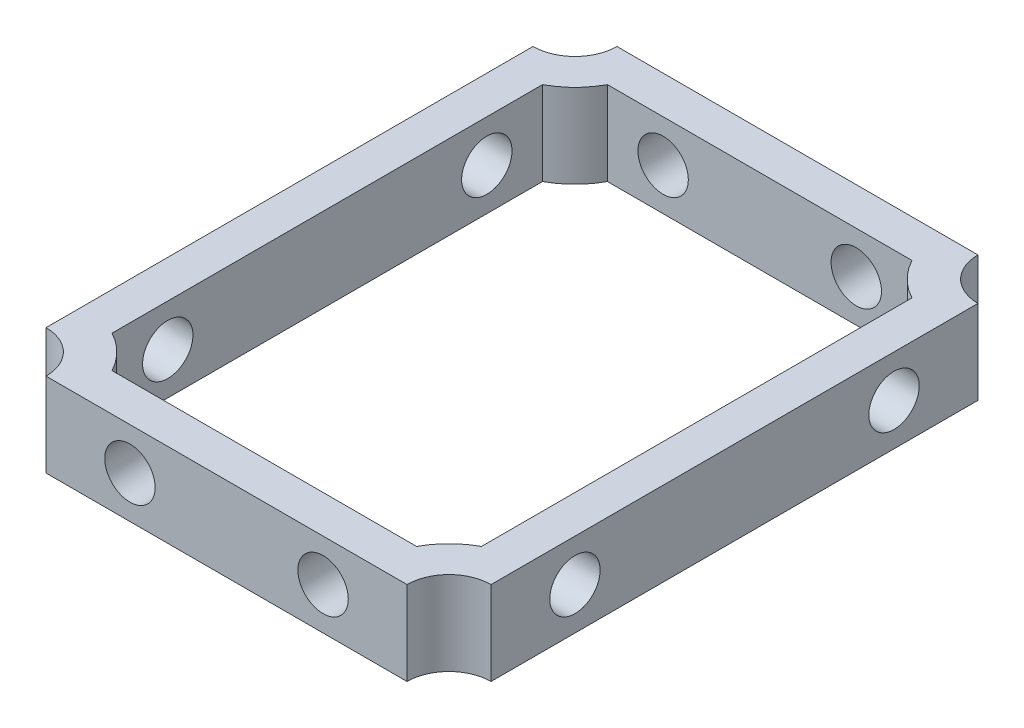
from build123d import *

# Parameters (mm, degrees)
BOSS_EXTRUDE1_DEPTH = 10
SKETCH2_R           = 3
CUT_EXTRUDE1_DEPTH  = 64.757352517
SKETCH3_R           = 3
CUT_EXTRUDE2_DEPTH  = 74.663084377


with BuildPart() as part:
    # Sketch1 → Boss-Extrude1 (new body)
    with BuildSketch(Plane(origin=(0, 0, 0), x_dir=(1, 0, 0), z_dir=(0, 1, 0))):
        with BuildLine():
            Line((-21.5, 34), (21.5, 34))
            ThreePointArc((21.5, 34), (22.964466094, 30.464466094), (26.5, 29))
            Line((26.5, 29), (26.5, -29))
            ThreePointArc((26.5, -29), (22.964466094, -30.464466094), (21.5, -34))
            Line((21.5, -34), (-21.5, -34))
            ThreePointArc((-21.5, -34), (-22.964466094, -30.464466094), (-26.5, -29))
            Line((-26.5, -29), (-26.5, 29))
            ThreePointArc((-26.5, 29), (-22.964466094, 30.464466094), (-21.5, 34))
        make_face()
        with BuildLine():
            Line((-22, 25.633399735), (-22, -25.633399735))
            ThreePointArc((-22, -25.633399735), (-19.782485579, -27.282485579), (-18.133399735, -29.5))
            Line((-18.133399735, -29.5), (18.133399735, -29.5))
            ThreePointArc((18.133399735, -29.5), (19.782485579, -27.282485579), (22, -25.633399735))
            Line((22, -25.633399735), (22, 25.633399735))
            ThreePointArc((22, 25.633399735), (19.782485579, 27.282485579), (18.133399735, 29.5))
            Line((18.133399735, 29.5), (-18.133399735, 29.5))
            ThreePointArc((-18.133399735, 29.5), (-19.782485579, 27.282485579), (-22, 25.633399735))
        make_face(mode=Mode.SUBTRACT)
    extrude(amount=BOSS_EXTRUDE1_DEPTH)

    # Sketch2 → Cut-Extrude1 (cut, through all)
    with BuildSketch(Plane(origin=(26.5, 0, 0), x_dir=(0, 0, -1), z_dir=(1, 0, 0))):
        with Locations((-19, 5)):
            Circle(SKETCH2_R)
        with Locations((19, 5)):
            Circle(SKETCH2_R)
    extrude(amount=-CUT_EXTRUDE1_DEPTH, mode=Mode.SUBTRACT)

    # Sketch3 → Cut-Extrude2 (cut, through all)
    with BuildSketch(Plane.XY.offset(34)):
        with Locations((11.5, 5)):
            Circle(SKETCH3_R)
        with Locations((-11.5, 5)):
            Circle(SKETCH3_R)
    extrude(amount=-CUT_EXTRUDE2_DEPTH, mode=Mode.SUBTRACT)


solid = part.part
